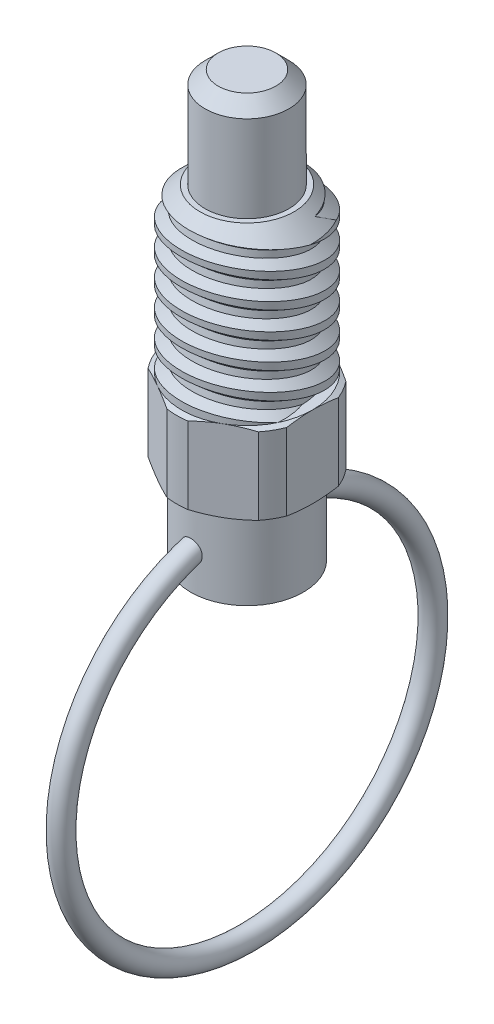
from build123d import *

# Parameters (mm, degrees)
SKETCH24_W          = 3.175
SKETCH24_H          = 7.874
LPATTERN1_COUNT     = 6
LPATTERN1_PITCH     = 1.27
LPATTERN1_COL_COUNT = 2
LPATTERN1_COL_PITCH = 1.27
SKETCH26_W          = 2.032
SKETCH26_H          = 7.0866
SKETCH36_W          = 0.519755273
SKETCH36_H          = 5.334
REVOLVE3_ANGLE      = 75
SKETCH21_OUTSIDE_W  = 11.466
SKETCH21_OUTSIDE_H  = 17.816
CUT_EXTRUDE12_DEPTH = 10.86705006
SKETCH38_W          = 2.7305
SKETCH38_H          = 7.874
EXTRUDE1_DEPTH      = 3.937
SKETCH39_R          = 0.51196875
SKETCH41_R          = 0.51196875
CHAMFER1_SIZE       = 0.635


with BuildPart() as part:
    # Sketch24 → Revolve1 (revolve)
    with BuildSketch(Plane(origin=(0, 0, 0), x_dir=(0, 0, -1), z_dir=(1, 0, 0)), mode=Mode.PRIVATE) as revolve1_sk:
        with Locations((1.5875, 0)):
            Rectangle(SKETCH24_W, SKETCH24_H)
    revolve(revolve1_sk.sketch.rotate(Axis((0, 3.937, 0), (0, -1, 0)), 180), axis=Axis((0, 3.937, 0), (0, -1, 0)))

    # Sketch6 → Cut-Revolve8 (revolve, cut)
    with BuildSketch(Plane(origin=(0, 0, 0), x_dir=(0, 0, -1), z_dir=(1, 0, 0))):
        Polygon((-3.206133436, 3.781332818), (-3.424067492, 2.691662542), (-2.672175229, 2.946018763), (-2.609908356, 3.257353128), align=None)
    cut_revolve8 = revolve(axis=Axis((0, 3.937, -0.272704483), (0, -0.9805806756909202, 0.196116135138184)), mode=Mode.SUBTRACT)

    # LPattern1: Cut-Revolve8 ×6
    with Locations(*[(0, -i * LPATTERN1_PITCH, 0) for i in range(1, LPATTERN1_COUNT)]):
        add(cut_revolve8, mode=Mode.SUBTRACT)

    # LPattern1 col: Cut-Revolve8 ×2
    with Locations(*[(0, i * LPATTERN1_COL_PITCH, 0) for i in range(1, LPATTERN1_COL_COUNT)]):
        add(cut_revolve8, mode=Mode.SUBTRACT)

    # Sketch26 → Cut-Revolve10 (revolve, cut)
    with BuildSketch(Plane(origin=(0, 0, 0), x_dir=(0, 0, -1), z_dir=(1, 0, 0)), mode=Mode.PRIVATE) as cut_revolve10_sk:
        with Locations((1.016, 0.3937)):
            Rectangle(SKETCH26_W, SKETCH26_H)
    revolve(cut_revolve10_sk.sketch.rotate(Axis((0, -3.1496, 0), (0, 1, 0)), 54.619043446), axis=Axis((0, -3.1496, 0), (0, 1, 0)), mode=Mode.SUBTRACT)

    # Sketch31 → Cut-Revolve13 (revolve, cut)
    with BuildSketch(Plane(origin=(0, 0, 0), x_dir=(0, 0, -1), z_dir=(1, 0, 0)), mode=Mode.PRIVATE) as cut_revolve13_sk:
        Polygon((3.175, 3.937), (2.286, 3.937), (3.175, 3.048), align=None)
    revolve(cut_revolve13_sk.sketch.rotate(Axis((0, 3.937, 0), (0, -1, 0)), 305.380956554), axis=Axis((0, 3.937, 0), (0, -1, 0)), mode=Mode.SUBTRACT)


with BuildPart() as body_2:
    # Sketch27 → Revolve2 (revolve)
    with BuildSketch(Plane(origin=(0, 0, 0), x_dir=(0, 0, -1), z_dir=(1, 0, 0)), mode=Mode.PRIVATE) as revolve2_sk:
        Polygon((2.032, 8.763), (2.032, 3.048), (0, 3.048), (0, 3.4925), (0, 8.763), align=None)
    revolve(revolve2_sk.sketch.rotate(Axis((0, 8.763, 0), (0, -1, 0)), 305.380956554), axis=Axis((0, 8.763, 0), (0, -1, 0)))

    # Chamfer1
    chamfer1_edges = [body_2.edges().sort_by_distance(p)[0] for p in [
        (1.656730823, 8.763, 1.176548758),
    ]]
    chamfer(chamfer1_edges, length=CHAMFER1_SIZE)


with BuildPart() as body_3:
    # Sketch36 → Revolve3 (revolve, symmetric)
    with BuildSketch(Plane.XY) as revolve3_sk:
        with Locations((-2.978622364, 0)):
            Rectangle(SKETCH36_W, SKETCH36_H)
    revolve(axis=Axis((0, 3.937, 0), (0, -1, 0)), revolution_arc=REVOLVE3_ANGLE / 2)
    revolve(revolve3_sk.sketch, axis=Axis((0, 3.937, 0), (0, 1, 0)), revolution_arc=REVOLVE3_ANGLE / 2)

    # Sketch21 outside → Cut-Extrude12 (cut, through all)
    with BuildSketch(Plane(origin=(0, 0, 0), x_dir=(0, 0, -1), z_dir=(1, 0, 0))):
        with Locations((0, 2.413)):
            Rectangle(SKETCH21_OUTSIDE_W, SKETCH21_OUTSIDE_H)
        with BuildLine():
            ThreePointArc((0.435493342, 0.337068342), (0, 0.51745559), (-0.435493342, 0.337068342))
            ThreePointArc((-0.435493342, 0.337068342), (-0.7381875, -0.3937), (-0.435493342, -1.124468342))
            ThreePointArc((-0.435493342, -1.124468342), (0, -1.30485559), (0.435493342, -1.124468342))
            ThreePointArc((0.435493342, -1.124468342), (0.7381875, -0.3937), (0.435493342, 0.337068342))
        make_face(mode=Mode.SUBTRACT)
    extrude(amount=-CUT_EXTRUDE12_DEPTH, mode=Mode.SUBTRACT)


with BuildPart() as part_1:
    add(part.part)

    # Combine4: union body 3
    add(body_3.part)

    # Sketch38 → Revolve4 (revolve)
    with BuildSketch(Plane(origin=(0, 0, 0), x_dir=(0, 0, -1), z_dir=(1, 0, 0)), mode=Mode.PRIVATE) as revolve4_sk:
        with Locations((1.36525, -7.874)):
            Rectangle(SKETCH38_W, SKETCH38_H)
    revolve(revolve4_sk.sketch.rotate(Axis((0, -3.937, 0), (0, -1, 0)), 305.380956554), axis=Axis((0, -3.937, 0), (0, -1, 0)))

    # Sketch42 → Extrude1 (add)
    with BuildSketch(Plane.XZ.offset(3.937)):
        Polygon((0, 3.666174209), (-3.175, 1.833087105), (-3.175, -1.833087105), (0, -3.666174209), (3.175, -1.833087105), (3.175, 1.833087105), align=None)
    extrude(amount=EXTRUDE1_DEPTH)

    # Sketch43 → Cut-Revolve15 (revolve, cut)
    with BuildSketch(Plane(origin=(0, 0, 0), x_dir=(0, 0, -1), z_dir=(1, 0, 0)), mode=Mode.PRIVATE) as cut_revolve15_sk:
        Polygon((-3.666174209, -3.937), (-3.175, -3.937), (-3.412174209, -4.04759615), (-3.412174209, -7.76340385), (-3.175, -7.874), (-3.666174209, -7.874), align=None)
    revolve(cut_revolve15_sk.sketch.rotate(Axis((0, -3.937, 0), (0, -1, 0)), 125.380956554), axis=Axis((0, -3.937, 0), (0, -1, 0)), mode=Mode.SUBTRACT)

    # Sketch39 → Cut-Revolve14 (revolve, cut)
    with BuildSketch(Plane.XY):
        with Locations((0, -9.65596875)):
            Circle(SKETCH39_R)
    revolve(axis=Axis((15.689456998, -18.669, 0), (-1, 0, 0)), mode=Mode.SUBTRACT)


with BuildPart() as body_3_2:
    # Sketch41 → Revolve5 (revolve)
    with BuildSketch(Plane.XY):
        with Locations((0, -9.65596875)):
            Circle(SKETCH41_R)
    revolve(axis=Axis((15.689456998, -18.669, 0), (-1, 0, 0)))


solid = Compound([body_2.part, part_1.part, body_3_2.part])
